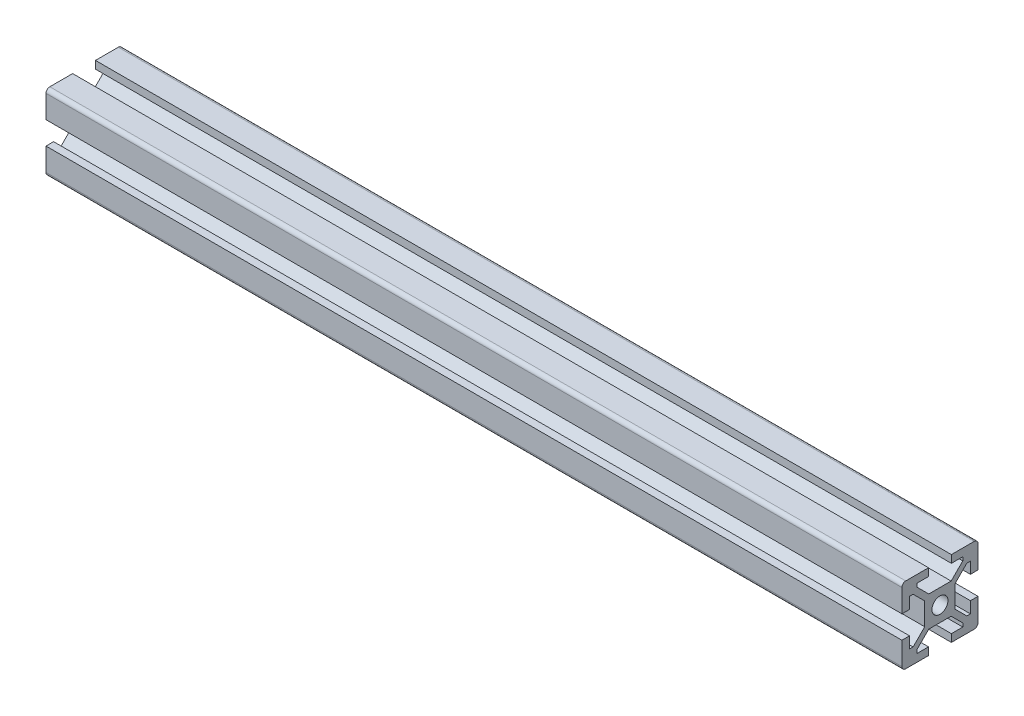
from build123d import *

# Parameters (mm, degrees)
SKETCH1_R           = 2.1
BOSS_EXTRUDE1_DEPTH = 225


with BuildPart() as part:
    # Sketch1 → Boss-Extrude1 (new body)
    with BuildSketch(Plane(origin=(0, 0, 0), x_dir=(0, 0, -1), z_dir=(1, 0, 0))):
        with BuildLine():
            Line((-10, 9), (-10, 3))
            Line((-10, 3), (-8, 3))
            Line((-8, 3), (-8, 6))
            Line((-8, 6), (-7.060660172, 6))
            Line((-7.060660172, 6), (-4, 2.939339828))
            Line((-4, 2.939339828), (-4, -2.939339828))
            Line((-4, -2.939339828), (-7.060660172, -6))
            Line((-7.060660172, -6), (-8, -6))
            Line((-8, -6), (-8, -3))
            Line((-8, -3), (-10, -3))
            Line((-10, -3), (-10, -9))
            ThreePointArc((-10, -9), (-9.707106781, -9.707106781), (-9, -10))
            Line((-9, -10), (-3, -10))
            Line((-3, -10), (-3, -8))
            Line((-3, -8), (-6, -8))
            Line((-6, -8), (-6, -7.060660172))
            Line((-6, -7.060660172), (-2.939339828, -4))
            Line((-2.939339828, -4), (2.939339828, -4))
            Line((2.939339828, -4), (6, -7.060660172))
            Line((6, -7.060660172), (6, -8))
            Line((6, -8), (3, -8))
            Line((3, -8), (3, -10))
            Line((3, -10), (9, -10))
            ThreePointArc((9, -10), (9.707106781, -9.707106781), (10, -9))
            Line((10, -9), (10, -3))
            Line((10, -3), (8, -3))
            Line((8, -3), (8, -6))
            Line((8, -6), (7.060660172, -6))
            Line((7.060660172, -6), (4, -2.939339828))
            Line((4, -2.939339828), (4, 2.939339828))
            Line((4, 2.939339828), (7.060660172, 6))
            Line((7.060660172, 6), (8, 6))
            Line((8, 6), (8, 3))
            Line((8, 3), (10, 3))
            Line((10, 3), (10, 9))
            ThreePointArc((10, 9), (9.707106781, 9.707106781), (9, 10))
            Line((9, 10), (3, 10))
            Line((3, 10), (3, 8))
            Line((3, 8), (6, 8))
            Line((6, 8), (6, 7.060660172))
            Line((6, 7.060660172), (2.939339828, 4))
            Line((2.939339828, 4), (-2.939339828, 4))
            Line((-2.939339828, 4), (-6, 7.060660172))
            Line((-6, 7.060660172), (-6, 8))
            Line((-6, 8), (-3, 8))
            Line((-3, 8), (-3, 10))
            Line((-3, 10), (-9, 10))
            ThreePointArc((-9, 10), (-9.707106781, 9.707106781), (-10, 9))
        make_face()
        Circle(SKETCH1_R, mode=Mode.SUBTRACT)
    extrude(amount=BOSS_EXTRUDE1_DEPTH)


solid = part.part
